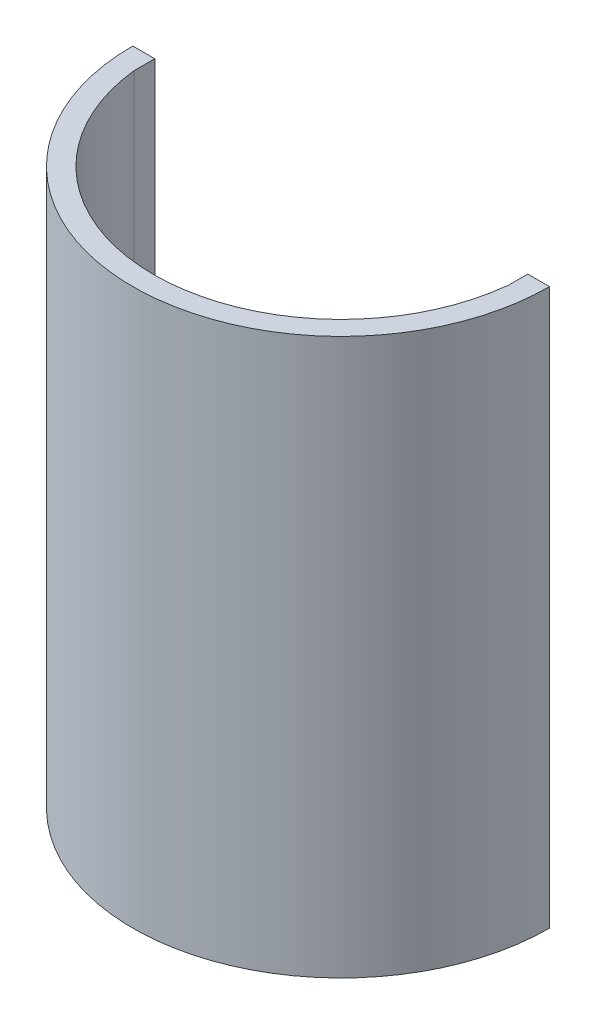
from build123d import *

# Parameters (mm, degrees)
BOSS_EXTRUDE1_DEPTH = 203.2
CUT_EXTRUDE1_DEPTH  = 203.2
SKETCH3_W           = 136.421155183
SKETCH3_H           = 7.62
CUT_EXTRUDE2_DEPTH  = 203.2


with BuildPart() as part:
    # Sketch1 → Boss-Extrude1 (new body)
    with BuildSketch(Plane(origin=(0, 0, 0), x_dir=(1, 0, 0), z_dir=(0, 1, 0))):
        with BuildLine():
            Line((-76.2, 0), (76.2, 0))
            ThreePointArc((76.2, 0), (0, -76.2), (-76.2, 0))
        make_face()
    extrude(amount=BOSS_EXTRUDE1_DEPTH)

    # Sketch2 → Cut-Extrude1 (cut)
    with BuildSketch(Plane(origin=(0, 203.2, 0), x_dir=(1, 0, 0), z_dir=(0, 1, 0))):
        with BuildLine():
            Line((68.155351954, -7.62), (-68.155351954, -7.62))
            ThreePointArc((-68.155351954, -7.62), (0, -68.58), (68.155351954, -7.62))
        make_face()
    extrude(amount=-CUT_EXTRUDE1_DEPTH, mode=Mode.SUBTRACT)

    # Sketch3 → Cut-Extrude2 (cut)
    with BuildSketch(Plane(origin=(0, 203.2, 0), x_dir=(1, 0, 0), z_dir=(0, 1, 0))):
        with Locations((0.055225637, -3.81)):
            Rectangle(SKETCH3_W, SKETCH3_H)
    extrude(amount=-CUT_EXTRUDE2_DEPTH, mode=Mode.SUBTRACT)


solid = part.part
